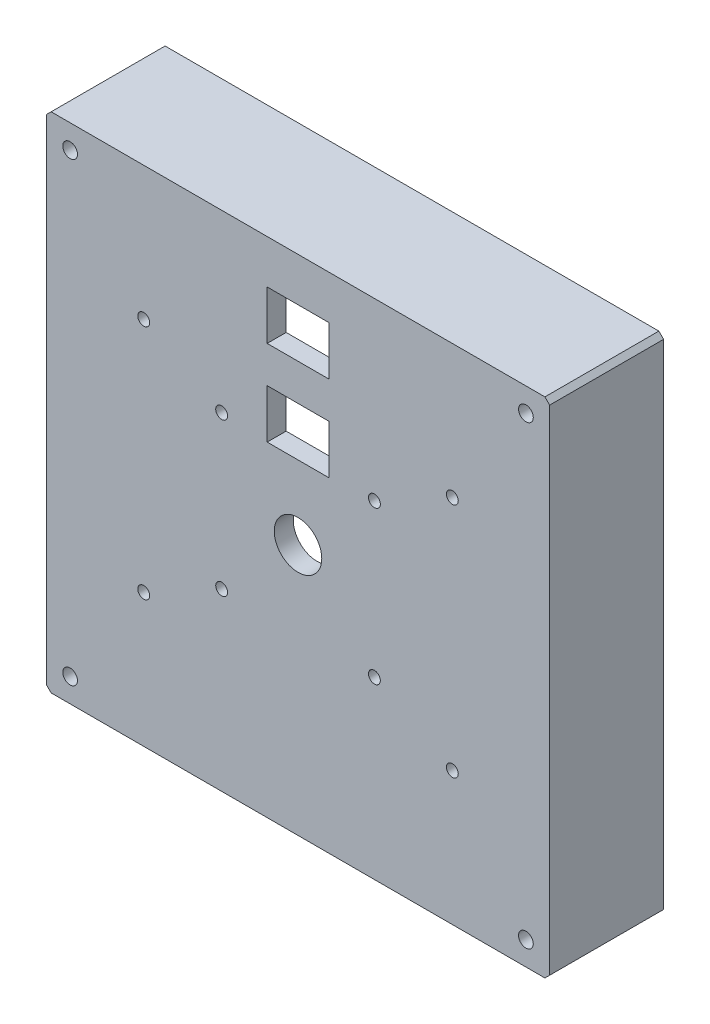
from build123d import *

# Parameters (mm, degrees)
SKETCH1_W               = 106
SKETCH1_H               = 106
BOSS_EXTRUDE1_DEPTH     = 4
SKETCH2_W               = 106
SKETCH2_H               = 106
BOSS_EXTRUDE2_DEPTH     = 20
SKETCH7_R               = 1.55
CUT_EXTRUDE2_DEPTH      = 50
SKETCH8_R               = 1.25
SKETCH8_R_2             = 5
SKETCH8_W               = 13
SKETCH8_H               = 10.3
CUT_EXTRUDE3_DEPTH      = 10
SKETCH9_R               = 4.5
BOSS_EXTRUDE3_DEPTH     = 4
SKETCH14_R              = 2.75
SKETCH14_W              = 13
SKETCH14_H              = 8
CUT_EXTRUDE4_DEPTH      = 10
CHAMFER1_SIZE           = 1
CHAMFER2_SIZE           = 1
CUT_EXTRUDE5_DEPTH      = 97
CUT_EXTRUDE5_DEPTH_BACK = 1
SKETCH15_R              = 1.6
CHAMFER3_SIZE           = 1


with BuildPart() as part:
    # Sketch1 → Boss-Extrude1 (new body)
    with BuildSketch(Plane.XY):
        Rectangle(SKETCH1_W, SKETCH1_H)
    extrude(amount=-BOSS_EXTRUDE1_DEPTH)

    # Sketch2 → Boss-Extrude2 (add)
    with BuildSketch(Plane(origin=(0, 0, -4), x_dir=(-1, 0, 0), z_dir=(0, 0, -1))):
        Rectangle(SKETCH2_W, SKETCH2_H)
        Polygon((-48, 41), (-48, -41), (-41, -48), (41, -48), (48, -41), (48, 41), (41, 48), (-41, 48), align=None, mode=Mode.SUBTRACT)
    extrude(amount=BOSS_EXTRUDE2_DEPTH)

    # Sketch7 → Cut-Extrude2 (cut)
    with BuildSketch(Plane.XY):
        with Locations((-48, 48)):
            Circle(SKETCH7_R)
        with Locations((48, 48)):
            Circle(SKETCH7_R)
        with Locations((-48, -48)):
            Circle(SKETCH7_R)
        with Locations((48, -48)):
            Circle(SKETCH7_R)
    extrude(amount=-CUT_EXTRUDE2_DEPTH, mode=Mode.SUBTRACT)

    # Sketch8 → Cut-Extrude3 (cut)
    with BuildSketch(Plane.XY):
        with Locations((32.5, 24.9)):
            Circle(SKETCH8_R)
        with Locations((-32.5, 24.9)):
            Circle(SKETCH8_R)
        with Locations((-32.5, -24.9)):
            Circle(SKETCH8_R)
        with Locations((32.5, -24.9)):
            Circle(SKETCH8_R)
        with Locations((16.086679272, -16.086679272)):
            Circle(SKETCH8_R)
        with Locations((-16.086679272, -16.086679272)):
            Circle(SKETCH8_R)
        with Locations((16.086679272, 16.086679272)):
            Circle(SKETCH8_R)
        with Locations((-16.086679272, 16.086679272)):
            Circle(SKETCH8_R)
        Circle(SKETCH8_R_2)
        with Locations((0, 38.65)):
            Rectangle(SKETCH8_W, SKETCH8_H)
        with Locations((0, 20.65)):
            Rectangle(SKETCH8_W, SKETCH8_H)
    extrude(amount=-CUT_EXTRUDE3_DEPTH, mode=Mode.SUBTRACT)

    # Sketch9 → Boss-Extrude3 (add)
    # profile 1 of 4: a face of its own
    with BuildSketch(Plane.XY.offset(-4)):
        with Locations((-34.5, 41)):
            Circle(SKETCH9_R)
        Polygon((-35.701219331, 38.1), (-33.298780669, 38.1), (-31.6, 39.798780669), (-31.6, 42.201219331), (-33.298780669, 43.9), (-35.701219331, 43.9), (-37.4, 42.201219331), (-37.4, 39.798780669), align=None, mode=Mode.SUBTRACT)
    # profile 2 of 4: a face of its own
    with BuildSketch(Plane.XY.offset(-4)):
        with Locations(Location((34.5, 41, 0), (0, 0, 180))):
            Circle(SKETCH9_R)
        Polygon((37.4, 39.798780669), (35.701219331, 38.1), (33.298780669, 38.1), (31.6, 39.798780669), (31.6, 42.201219331), (33.298780669, 43.9), (35.701219331, 43.9), (37.4, 42.201219331), align=None, mode=Mode.SUBTRACT)
    # profile 3 of 4: a face of its own
    with BuildSketch(Plane.XY.offset(-4)):
        with Locations((34.5, -41)):
            Circle(SKETCH9_R)
        Polygon((35.701219331, -38.1), (33.298780669, -38.1), (31.6, -39.798780669), (31.6, -42.201219331), (33.298780669, -43.9), (35.701219331, -43.9), (37.4, -42.201219331), (37.4, -39.798780669), align=None, mode=Mode.SUBTRACT)
    # profile 4 of 4: a face of its own
    with BuildSketch(Plane.XY.offset(-4)):
        with Locations(Location((-34.5, -41, 0), (0, 0, 180))):
            Circle(SKETCH9_R)
        Polygon((-37.4, -39.798780669), (-35.701219331, -38.1), (-33.298780669, -38.1), (-31.6, -39.798780669), (-31.6, -42.201219331), (-33.298780669, -43.9), (-35.701219331, -43.9), (-37.4, -42.201219331), align=None, mode=Mode.SUBTRACT)
    extrude(amount=-BOSS_EXTRUDE3_DEPTH)

    # Sketch14 → Cut-Extrude4 (cut)
    with BuildSketch(Plane.XZ.offset(53)):
        with Locations((20, -18)):
            Circle(SKETCH14_R)
        with Locations((0, -10.83)):
            Rectangle(SKETCH14_W, SKETCH14_H)
    extrude(amount=-CUT_EXTRUDE4_DEPTH, mode=Mode.SUBTRACT)

    # Chamfer1
    chamfer1_edges = [part.edges().sort_by_distance(p)[0] for p in [
        (-53, 53, -12),
        (53, 53, -12),
        (53, -53, -12),
        (-53, -53, -12),
    ]]
    chamfer(chamfer1_edges, length=CHAMFER1_SIZE)

    # Chamfer2
    chamfer2_edges = [part.edges().sort_by_distance(p)[0] for p in [
        (-6.5, -53, -10.83),
        (0, -53, -14.83),
        (6.5, -53, -10.83),
        (0, -53, -6.83),
    ]]
    chamfer(chamfer2_edges, length=CHAMFER2_SIZE)

    # Sketch15 → Cut-Extrude5 (cut, two sides: drawn at the far end of the back side and taken through both)
    with BuildSketch(Plane.ZY.offset(-48).offset(-CUT_EXTRUDE5_DEPTH_BACK)):
        with Locations(Location((-12, -23, 0), (0, 0, 90))):
            Circle(SKETCH15_R)
        with Locations(Location((-12, 23, 0), (0, 0, 90))):
            Circle(SKETCH15_R)
    extrude(amount=CUT_EXTRUDE5_DEPTH + CUT_EXTRUDE5_DEPTH_BACK, mode=Mode.SUBTRACT)

    # Chamfer3
    chamfer3_edges = [part.edges().sort_by_distance(p)[0] for p in [
        (17.25, -48, -18),
        (17.25, -53, -18),
    ]]
    chamfer(chamfer3_edges, length=CHAMFER3_SIZE)


solid = part.part
